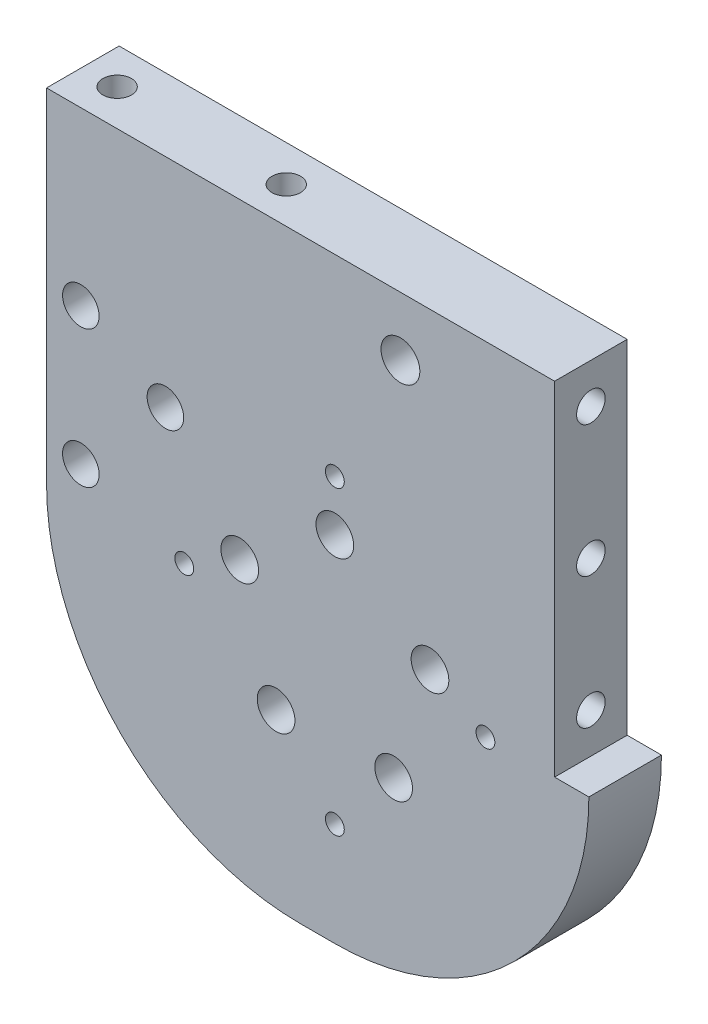
from build123d import *

# Parameters (mm, degrees)
BOSS_EXTRUDE1_DEPTH                             = 12.7
M4X0_7_TAPPED_HOLE1_D                           = 3.3
M8X1_25_TAPPED_HOLE1_D                          = 6.8
CSK_FOR_M6_FLAT_HEAD_MACHINE_SCREW1_D           = 6.4
CSK_FOR_M6_FLAT_HEAD_MACHINE_SCREW1_CSINK_D     = 12.6
CSK_FOR_M6_FLAT_HEAD_MACHINE_SCREW1_CSINK_ANGLE = 90
M6X1_0_TAPPED_HOLE2_D                           = 5
M6X1_0_TAPPED_HOLE2_DEPTH                       = 15
M6X1_0_TAPPED_HOLE2_TIP                         = 1.502151548
M6X1_0_TAPPED_HOLE1_D                           = 5
M6X1_0_TAPPED_HOLE1_DEPTH                       = 15
M6X1_0_TAPPED_HOLE1_TIP                         = 1.502151548
CSK_FOR_M6_FLAT_HEAD_MACHINE_SCREW2_D           = 6.4
CSK_FOR_M6_FLAT_HEAD_MACHINE_SCREW2_CSINK_D     = 12.6
CSK_FOR_M6_FLAT_HEAD_MACHINE_SCREW2_CSINK_ANGLE = 90
F_1_3_4_CLEARANCE_HOLE1_D                       = 45
F_1_3_4_CLEARANCE_HOLE1_DEPTH                   = 5
M6_CLEARANCE_HOLE1_D                            = 6.6
FILLET1_R                                       = 44.45


with BuildPart() as part:
    # Sketch1 → Boss-Extrude1 (new body)
    with BuildSketch(Plane(origin=(0, 0, 0), x_dir=(-1, 0, 0), z_dir=(0, 0, -1))):
        with BuildLine():
            Line((-6, -44.45), (44.45, -44.45))
            Line((44.45, -44.45), (44.45, 60))
            Line((44.45, 60), (-44.45, 60))
            Line((-44.45, 60), (-44.45, 0))
            Line((-44.45, 0), (-50.45, 0))
            ThreePointArc((-50.45, 0), (-37.430896424, -31.430896424), (-6, -44.45))
        make_face()
    extrude(amount=-BOSS_EXTRUDE1_DEPTH)

    # M4x0.7 Tapped Hole1 (through all)
    with Locations(Plane.XY.offset(12.7)):
        with Locations((32.349998458, 0.009014041), (6, -26.35), (-20.349998115, -0.009967087), (6, 26.35)):
            Hole(M4X0_7_TAPPED_HOLE1_D / 2)

    # M8x1.25 Tapped Hole1 (through all)
    with Locations(Plane.XY.offset(12.7)):
        with Locations((17.47250377, 49.692873304)):
            Hole(M8X1_25_TAPPED_HOLE1_D / 2)

    # CSK for M6 Flat Head Machine Screw1 (through all)
    with Locations(Plane(origin=(0, 0, 0), x_dir=(-1, 0, 0), z_dir=(0, 0, -1))):
        with Locations((23.65, 22)):
            CounterSinkHole(CSK_FOR_M6_FLAT_HEAD_MACHINE_SCREW1_D / 2, CSK_FOR_M6_FLAT_HEAD_MACHINE_SCREW1_CSINK_D / 2, counter_sink_angle=CSK_FOR_M6_FLAT_HEAD_MACHINE_SCREW1_CSINK_ANGLE)

    # M6x1.0 Tapped Hole2
    with Locations(Plane(origin=(44.45, 0, 0), x_dir=(0, 0, -1), z_dir=(1, 0, 0))):
        with Locations((-6.35, 7), (-6.35, 53), (-6.35, 30)):
            Hole(M6X1_0_TAPPED_HOLE2_D / 2, depth=M6X1_0_TAPPED_HOLE2_DEPTH)
            with Locations((0, 0, -(M6X1_0_TAPPED_HOLE2_DEPTH + M6X1_0_TAPPED_HOLE2_TIP / 2))):  # 118° drill point
                Cone(0, M6X1_0_TAPPED_HOLE2_D / 2, M6X1_0_TAPPED_HOLE2_TIP, mode=Mode.SUBTRACT)

    # M6x1.0 Tapped Hole1
    with Locations(Plane(origin=(0, 60, 0), x_dir=(1, 0, 0), z_dir=(0, 1, 0))):
        with Locations((-38.45, -6.35), (-8.85, -6.35)):
            Hole(M6X1_0_TAPPED_HOLE1_D / 2, depth=M6X1_0_TAPPED_HOLE1_DEPTH)
            with Locations((0, 0, -(M6X1_0_TAPPED_HOLE1_DEPTH + M6X1_0_TAPPED_HOLE1_TIP / 2))):  # 118° drill point
                Cone(0, M6X1_0_TAPPED_HOLE1_D / 2, M6X1_0_TAPPED_HOLE1_TIP, mode=Mode.SUBTRACT)

    # CSK for M6 Flat Head Machine Screw2 (through all)
    with Locations(Plane(origin=(0, 0, 0), x_dir=(-1, 0, 0), z_dir=(0, 0, -1))):
        with Locations((38.45, 30), (38.45, 6)):
            CounterSinkHole(CSK_FOR_M6_FLAT_HEAD_MACHINE_SCREW2_D / 2, CSK_FOR_M6_FLAT_HEAD_MACHINE_SCREW2_CSINK_D / 2, counter_sink_angle=CSK_FOR_M6_FLAT_HEAD_MACHINE_SCREW2_CSINK_ANGLE)

    # 1-3/4 Clearance Hole1
    with Locations(Plane(origin=(0, 0, 0), x_dir=(-1, 0, 0), z_dir=(0, 0, -1))):
        with Locations((-6, 0)):
            Hole(F_1_3_4_CLEARANCE_HOLE1_D / 2, depth=F_1_3_4_CLEARANCE_HOLE1_DEPTH)

    # M6 Clearance Hole1 (through all)
    with Locations(Plane.XY.offset(12.7)):
        with Locations((6, 17.5), (22.643489035, 5.407797402), (16.286241915, -14.157797402), (-4.286241915, -14.157797402), (-10.643489035, 5.407797402)):
            Hole(M6_CLEARANCE_HOLE1_D / 2)

    # Fillet1
    fillet1_edges = [part.edges().sort_by_distance(p)[0] for p in [
        (-44.45, -44.45, 6.35),
    ]]
    fillet(fillet1_edges, radius=FILLET1_R)


solid = part.part
